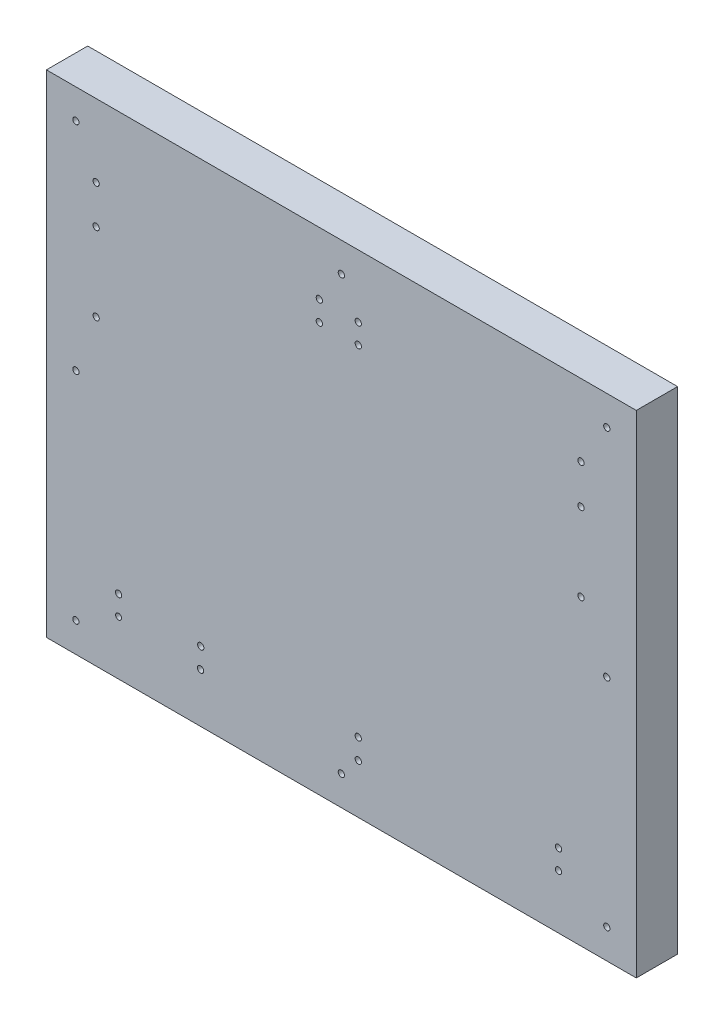
from build123d import *

# Parameters (mm, degrees)
SKIZZE1_W                       = 300
SKIZZE1_H                       = 250
SKIZZE1_R                       = 1.6
AUFSATZ_LINEAR_AUSTRAGEN5_DEPTH = 21
SKIZZE2_R                       = 1.6
SKIZZE2_R_2                     = 1.5
SCHNITT_LINEAR_AUSTRAGEN2_DEPTH = 21
SKIZZE4_W                       = 45.307875895
SKIZZE4_H                       = 28.066825776
SCHNITT_LINEAR_AUSTRAGEN4_DEPTH = 1


with BuildPart() as part:
    # Skizze1 → Aufsatz-Linear austragen5 (new body)
    with BuildSketch(Plane.XY):
        with Locations((150, 125)):
            Rectangle(SKIZZE1_W, SKIZZE1_H)
        with Locations(Location((15, 15, 0), (0, 0, 180))):
            Circle(SKIZZE1_R, mode=Mode.SUBTRACT)
        with Locations(Location((285, 15, 0), (0, 0, 180))):
            Circle(SKIZZE1_R, mode=Mode.SUBTRACT)
        with Locations(Location((285, 235, 0), (0, 0, 180))):
            Circle(SKIZZE1_R, mode=Mode.SUBTRACT)
        with Locations(Location((15, 235, 0), (0, 0, 180))):
            Circle(SKIZZE1_R, mode=Mode.SUBTRACT)
        with Locations(Location((150, 15, 0), (0, 0, 180))):
            Circle(SKIZZE1_R, mode=Mode.SUBTRACT)
        with Locations(Location((285, 125, 0), (0, 0, 180))):
            Circle(SKIZZE1_R, mode=Mode.SUBTRACT)
        with Locations(Location((15, 125, 0), (0, 0, 180))):
            Circle(SKIZZE1_R, mode=Mode.SUBTRACT)
        with Locations(Location((150, 235, 0), (0, 0, 180))):
            Circle(SKIZZE1_R, mode=Mode.SUBTRACT)
    extrude(amount=AUFSATZ_LINEAR_AUSTRAGEN5_DEPTH)

    # Skizze2 → Schnitt-Linear austragen2 (cut)
    with BuildSketch(Plane.XY):
        with Locations(Location((158.603155074, 25.118294, 0), (0, 0, 180))):
            Circle(SKIZZE2_R)
        with Locations(Location((158.603155074, 35.36547744, 0), (0, 0, 180))):
            Circle(SKIZZE2_R)
        with Locations(Location((260.44562916, 27.513648646, 0), (0, 0, 180))):
            Circle(SKIZZE2_R)
        with Locations(Location((260.44562916, 37.512496181, 0), (0, 0, 180))):
            Circle(SKIZZE2_R)
        with Locations(Location((271.872836796, 153.81431076, 0), (0, 0, 180))):
            Circle(SKIZZE2_R)
        with Locations(Location((271.872850829, 193.508875377, 0), (0, 0, 180))):
            Circle(SKIZZE2_R)
        with Locations(Location((271.872850829, 213.356130747, 0), (0, 0, 180))):
            Circle(SKIZZE2_R)
        with Locations(Location((158.603451148, 218.134079373, 0), (0, 0, 180))):
            Circle(SKIZZE2_R)
        with Locations(Location((138.798289388, 208.167325209, 0), (0, 0, 180))):
            Circle(SKIZZE2_R)
        with Locations(Location((158.60315708, 208.111977885, 0), (0, 0, 180))):
            Circle(SKIZZE2_R)
        with Locations(Location((138.79828939, 218.357599581, 0), (0, 0, 180))):
            Circle(SKIZZE2_R)
        with Locations(Location((25.285732641, 193.508839291, 0), (0, 0, 180))):
            Circle(SKIZZE2_R)
        with Locations(Location((25.28570124, 213.065385973, 0), (0, 0, 180))):
            Circle(SKIZZE2_R)
        with Locations(Location((25.285701244, 153.814310759, 0), (0, 0, 180))):
            Circle(SKIZZE2_R)
        with Locations(Location((78.40440781, 25.118294004, 0), (0, 0, 180))):
            Circle(SKIZZE2_R)
        with Locations(Location((36.712941278, 27.513648641, 0), (0, 0, 180))):
            Circle(SKIZZE2_R_2)
        with Locations(Location((36.71294128, 37.560163652, 0), (0, 0, 180))):
            Circle(SKIZZE2_R)
        with Locations(Location((78.512463953, 35.365477438, 0), (0, 0, 180))):
            Circle(SKIZZE2_R)
    extrude(amount=SCHNITT_LINEAR_AUSTRAGEN2_DEPTH, mode=Mode.SUBTRACT)

    # Skizze4 → Schnitt-Linear austragen4 (cut)
    with BuildSketch(Plane.XY):
        Polygon((270.870452166, 12.477849124), (241.801240756, 12.477849124), (241.801240756, 20.496942202), (255.834654648, 20.496942202), (255.834654648, 42.549448169), (270.870452166, 42.549448169), align=None)
        Polygon((55.357331688, 12.477849124), (26.288120277, 12.477849124), (26.288120277, 42.549448169), (41.3239188, 42.549448169), (41.3239188, 20.496942202), (55.357331688, 20.496942202), align=None)
        Polygon((171.233227678, 20.99813552), (146.073322141, 20.99813552), (146.073322141, 41.045868217), (91.042295889, 41.045868217), (91.042295889, 20.99813552), (70.994563187, 20.99813552), (70.994563187, 49.064960293), (171.233227678, 49.064960293), align=None)
        with Locations((148.579289731, 208.444436236)):
            Rectangle(SKIZZE4_W, SKIZZE4_H)
        Polygon((276.884788012, 141.785725019), (238.794086862, 141.785725019), (238.794086862, 146.797660198), (262.851375124, 146.797660198), (262.851375124, 221.976656809), (238.794086862, 221.976656809), (238.794086862, 232.000523157), (276.884788012, 232.000523157), align=None)
        Polygon((58.364491591, 141.785725019), (20.273798467, 141.785725019), (20.273798467, 232.000523157), (58.364491591, 232.000523157), (58.364491591, 221.976656809), (34.307212355, 221.976656809), (34.307212355, 146.797660198), (58.364491591, 146.797660198), align=None)
    extrude(amount=SCHNITT_LINEAR_AUSTRAGEN4_DEPTH, mode=Mode.SUBTRACT)


solid = part.part
